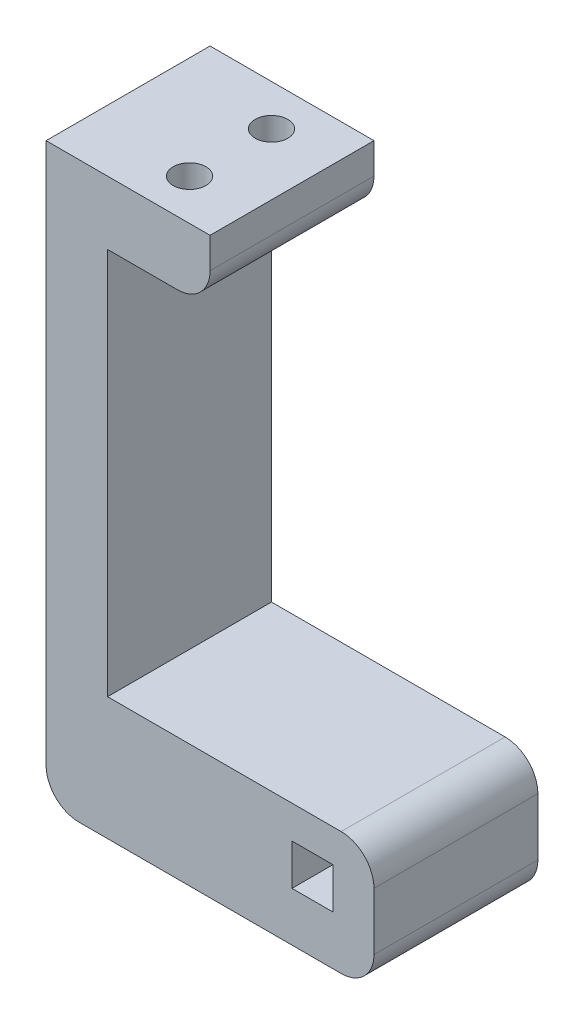
from build123d import *

# Parameters (mm, degrees)
BOSS_EXTRUDE1_DEPTH = 25.4
SKETCH2_W           = 12.7
SKETCH2_H           = 12.7
CUT_EXTRUDE1_DEPTH  = 50.8
SKETCH3_R           = 5.072330543
CUT_EXTRUDE2_DEPTH  = 50.8


with BuildPart() as part:
    # Sketch1 → Boss-Extrude1 (new, symmetric)
    with BuildSketch(Plane.XY):
        with BuildLine():
            Line((10.16, 0), (91.44, 0))
            ThreePointArc((91.44, 0), (98.624204897, 2.975795103), (101.6, 10.16))
            Line((101.6, 10.16), (101.6, 27.94))
            ThreePointArc((101.6, 27.94), (98.624204897, 35.124204897), (91.44, 38.1))
            Line((91.44, 38.1), (19.05, 38.1))
            Line((19.05, 38.1), (19.05, 158.129767442))
            Line((19.05, 158.129767442), (40.64, 158.129767442))
            ThreePointArc((40.64, 158.129767442), (47.824204897, 161.105562545), (50.8, 168.289767442))
            Line((50.8, 168.289767442), (50.8, 177.8))
            Line((50.8, 177.8), (0, 177.8))
            Line((0, 177.8), (0, 10.16))
            ThreePointArc((0, 10.16), (2.975795103, 2.975795103), (10.16, 0))
        make_face()
    extrude(amount=BOSS_EXTRUDE1_DEPTH, both=True)

    # Sketch2 → Cut-Extrude1 (cut)
    with BuildSketch(Plane.XY.offset(25.4)):
        with Locations((82.55, 21.59)):
            Rectangle(SKETCH2_W, SKETCH2_H)
    extrude(amount=-CUT_EXTRUDE1_DEPTH, mode=Mode.SUBTRACT)

    # Sketch3 → Cut-Extrude2 (cut)
    with BuildSketch(Plane.XZ.offset(-158.129767442)):
        with Locations(Location((31.75, 12.7, 0), (0, 0, 270))):
            Circle(SKETCH3_R)
        with Locations(Location((31.75, -12.7, 0), (0, 0, 270))):
            Circle(SKETCH3_R)
    extrude(amount=-CUT_EXTRUDE2_DEPTH, mode=Mode.SUBTRACT)


solid = part.part
